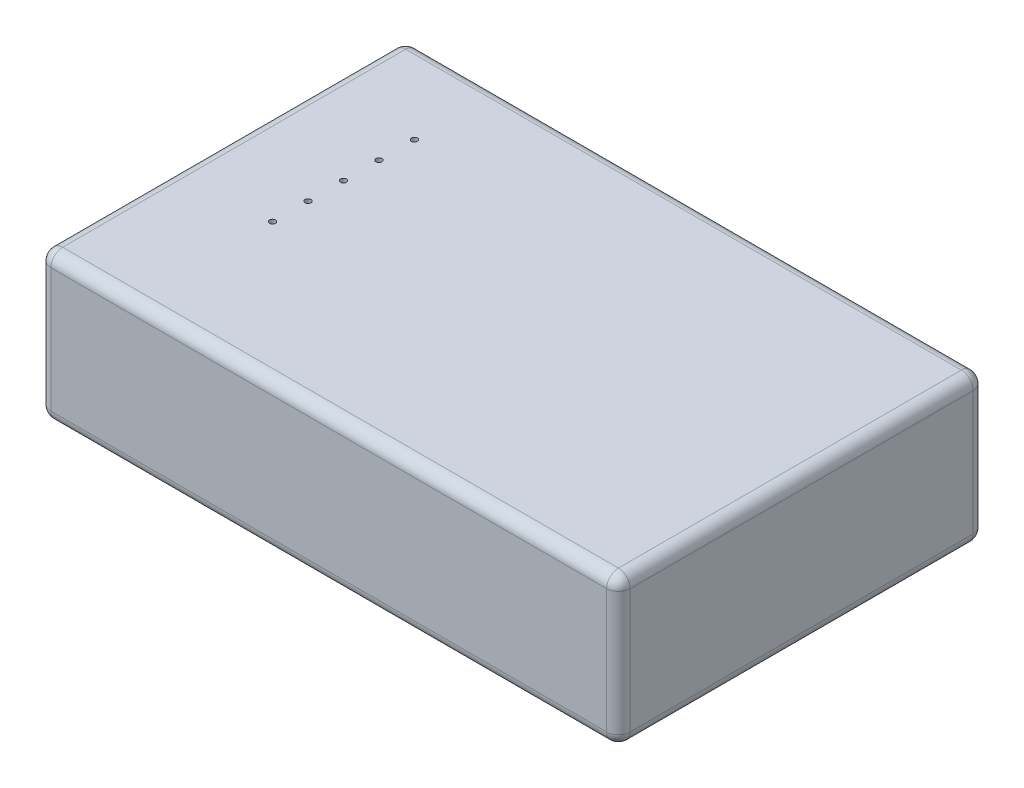
from build123d import *

# Parameters (mm, degrees)
SKETCH2_W           = 98
SKETCH2_H           = 62
BOSS_EXTRUDE1_DEPTH = 25
SKETCH3_W           = 9.5
SKETCH3_H           = 12
BOSS_EXTRUDE4_DEPTH = 1
SKETCH3_5_W         = 9.5
SKETCH3_5_H         = 12
CUT_EXTRUDE1_DEPTH  = 1
SKETCH4_R           = 3.25
CUT_EXTRUDE2_DEPTH  = 10
SKETCH5_R           = 0.5
BOSS_EXTRUDE5_DEPTH = 8
SKETCH6_W           = 7
SKETCH6_H           = 14
CUT_EXTRUDE9_DEPTH  = 10
SKETCH7_W           = 1.559437484
SKETCH7_H           = 10
BOSS_EXTRUDE6_DEPTH = 9
SKETCH8_W           = 15
SKETCH8_H           = 10
BOSS_EXTRUDE7_DEPTH = 2
BOSS_EXTRUDE7_TAPER = 30
FILLET5_R           = 2
SKETCH10_R          = 2.5
CUT_EXTRUDE10_DEPTH = 6
SKETCH11_R          = 0.5
CUT_EXTRUDE11_DEPTH = 3


with BuildPart() as part:
    # Sketch2 → Boss-Extrude1 (new body)
    with BuildSketch(Plane(origin=(0, 0, 0), x_dir=(1, 0, 0), z_dir=(0, 1, 0))):
        Rectangle(SKETCH2_W, SKETCH2_H)
    extrude(amount=BOSS_EXTRUDE1_DEPTH)

    # Sketch3 → Boss-Extrude4 (add)
    with BuildSketch(Plane.ZY.offset(49)):
        with Locations((-18.656971736, 15)):
            Rectangle(SKETCH3_W, SKETCH3_H)
    extrude(amount=-BOSS_EXTRUDE4_DEPTH)

    # Sketch3<5> → Cut-Extrude1 (cut)
    with BuildSketch(Plane.ZY.offset(49)):
        with Locations((-18.656971736, 15)):
            Rectangle(SKETCH3_5_W, SKETCH3_5_H)
    extrude(amount=-CUT_EXTRUDE1_DEPTH, mode=Mode.SUBTRACT)

    # Sketch4 → Cut-Extrude2 (cut)
    with BuildSketch(Plane.ZY.offset(48)):
        with Locations((-18.406971736, 16)):
            Circle(SKETCH4_R)
    extrude(amount=-CUT_EXTRUDE2_DEPTH, mode=Mode.SUBTRACT)

    # Sketch5 → Boss-Extrude5 (add)
    with BuildSketch(Plane.ZY.offset(38)):
        with Locations((-18.406971736, 16)):
            Circle(SKETCH5_R)
    extrude(amount=BOSS_EXTRUDE5_DEPTH)

    # Sketch6 → Cut-Extrude9 (cut)
    with BuildSketch(Plane.ZY.offset(49)):
        with Locations((-6.406971736, 14)):
            Rectangle(SKETCH6_W, SKETCH6_H)
    extrude(amount=-CUT_EXTRUDE9_DEPTH, mode=Mode.SUBTRACT)

    # Sketch7 → Boss-Extrude6 (add)
    with BuildSketch(Plane.ZY.offset(39)):
        with Locations((-4.686690478, 14)):
            Rectangle(SKETCH7_W, SKETCH7_H)
    extrude(amount=BOSS_EXTRUDE6_DEPTH)

    # Sketch8 → Boss-Extrude7 (add)
    with BuildSketch(Plane.ZY.offset(49)):
        with Locations((12.093028264, 15)):
            Rectangle(SKETCH8_W, SKETCH8_H)
    extrude(amount=BOSS_EXTRUDE7_DEPTH, taper=BOSS_EXTRUDE7_TAPER)

    # Fillet5
    fillet5_edges = [part.edges().sort_by_distance(p)[0] for p in [
        (49, 12.5, -31),
        (0, 25, -31),
        (-49, 12.5, -31),
        (0, 0, -31),
        (-49, 0, 0),
        (-49, 12.5, 31),
        (0, 0, 31),
        (49, 0, 0),
        (49, 25, 0),
        (49, 12.5, 31),
        (-49, 25, 0),
        (0, 25, 31),
    ]]
    fillet(fillet5_edges, radius=FILLET5_R)

    # Sketch10 → Cut-Extrude10 (cut)
    with BuildSketch(Plane.XZ):
        with Locations((-43, -25.5)):
            Circle(SKETCH10_R)
        with Locations((-43, 25.5)):
            Circle(SKETCH10_R)
        with Locations((43, 25.5)):
            Circle(SKETCH10_R)
        with Locations((43, -25.5)):
            Circle(SKETCH10_R)
    extrude(amount=-CUT_EXTRUDE10_DEPTH, mode=Mode.SUBTRACT)

    # Sketch11 → Cut-Extrude11 (cut)
    with BuildSketch(Plane(origin=(0, 25, 0), x_dir=(1, 0, 0), z_dir=(0, 1, 0))):
        with Locations((-33, 16.5)):
            Circle(SKETCH11_R)
        with Locations((-33, 10.5)):
            Circle(SKETCH11_R)
        with Locations((-33, 4.5)):
            Circle(SKETCH11_R)
        with Locations((-33, -1.5)):
            Circle(SKETCH11_R)
        with Locations((-33, -7.5)):
            Circle(SKETCH11_R)
    extrude(amount=-CUT_EXTRUDE11_DEPTH, mode=Mode.SUBTRACT)


solid = part.part
